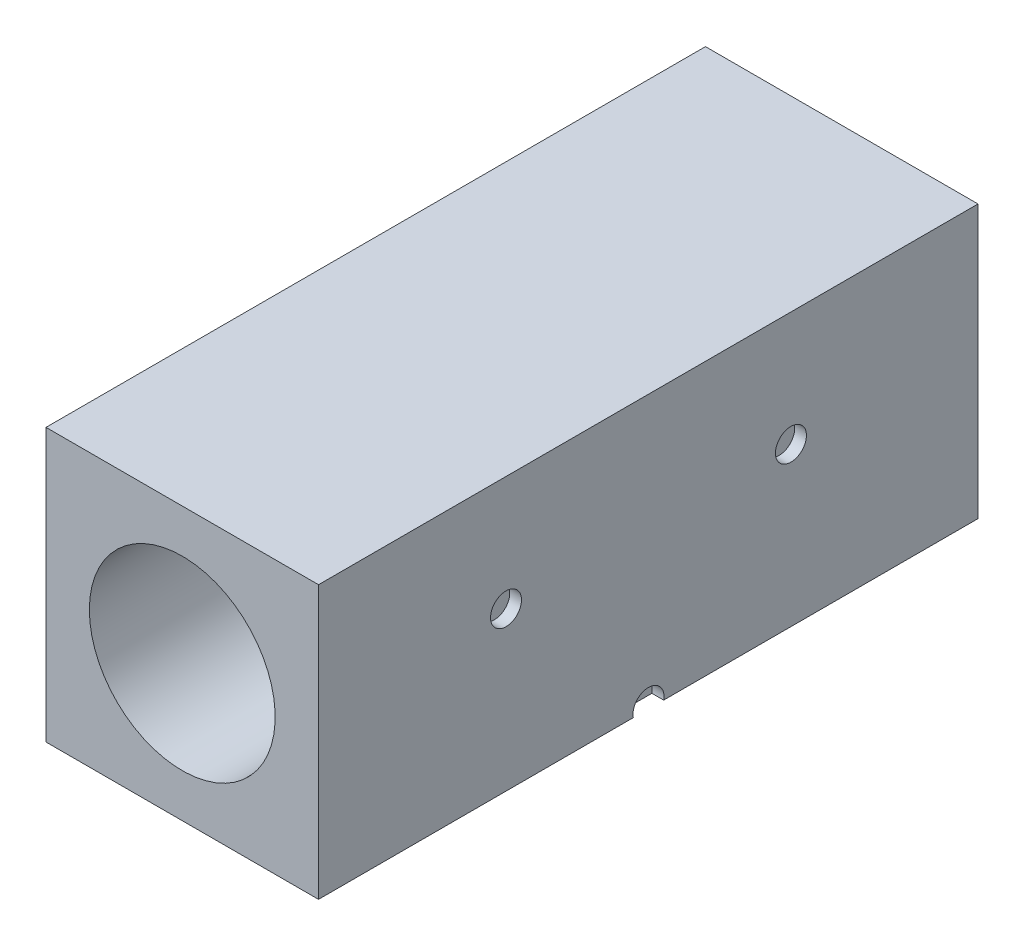
from build123d import *

# Parameters (mm, degrees)
SKETCH1_W           = 44
SKETCH1_H           = 44
BOSS_EXTRUDE1_DEPTH = 106.47
SKETCH5_R           = 15
CUT_EXTRUDE2_DEPTH  = 106.47
SKETCH10_R          = 2.5
CUT_EXTRUDE9_DEPTH  = 1.9


with BuildPart() as part:
    # Sketch1 → Boss-Extrude1 (new body)
    with BuildSketch(Plane.XY):
        Rectangle(SKETCH1_W, SKETCH1_H)
    extrude(amount=BOSS_EXTRUDE1_DEPTH)

    # Sketch5 → Cut-Extrude2 (cut)
    with BuildSketch(Plane(origin=(0, 0, 0), x_dir=(-1, 0, 0), z_dir=(0, 0, -1))):
        Circle(SKETCH5_R)
    extrude(amount=-CUT_EXTRUDE2_DEPTH, mode=Mode.SUBTRACT)

    # Sketch10 → Cut-Extrude9 (cut)
    with BuildSketch(Plane.ZY.offset(22)):
        with Locations((30.2, 3.5)):
            Circle(SKETCH10_R)
        with Locations((76.2, 3.5)):
            Circle(SKETCH10_R)
        with Locations((53.2, -21.499217988)):
            Circle(SKETCH10_R)
    cut_extrude9 = extrude(amount=-CUT_EXTRUDE9_DEPTH, mode=Mode.SUBTRACT)

    # Mirror1: Cut-Extrude9 across plane
    add(cut_extrude9.mirror(Plane(origin=(0, 0, 0), x_dir=(0, 0, 1), z_dir=(1, 0, 0))), mode=Mode.SUBTRACT)


solid = part.part
